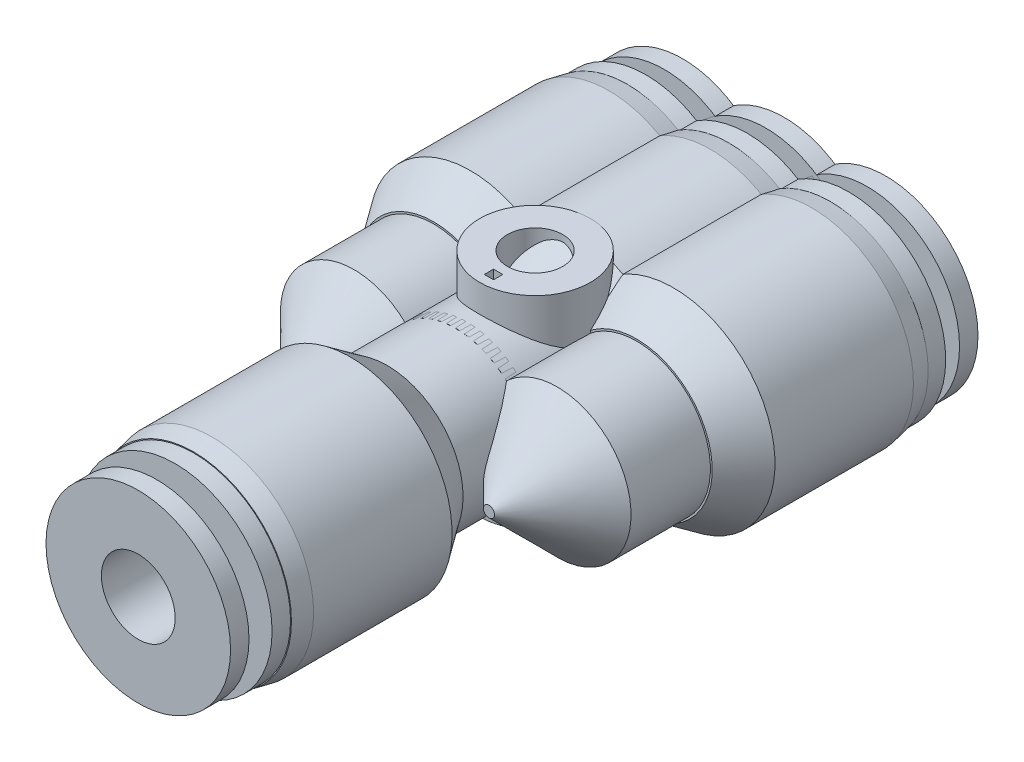
from build123d import *

# Parameters (mm, degrees)
SKETCH1_R           = 5
BOSS_EXTRUDE1_DEPTH = 1
SKETCH3_R           = 3
BOSS_EXTRUDE2_DEPTH = 1
SKETCH4_R           = 5.25
BOSS_EXTRUDE3_DEPTH = 1
SKETCH5_R           = 5.5
BOSS_EXTRUDE4_DEPTH = 10.5
SKETCH6_R           = 4
BOSS_EXTRUDE5_DEPTH = 8
CHAMFER1_SIZE       = 0.2
CHAMFER1_SIZE2      = 1
CHAMFER2_SIZE       = 2
CHAMFER2_SIZE2      = 1.4
CHAMFER3_SIZE       = 3.7
SKETCH11_R          = 2
CUT_EXTRUDE2_DEPTH  = 10
LPATTERN1_COUNT     = 3
LPATTERN1_PITCH     = 5.5
SKETCH8_R           = 3
BOSS_EXTRUDE7_DEPTH = 5.5
SKETCH9_R           = 1.5
CUT_EXTRUDE1_DEPTH  = 41.227478171
SKETCH12_W          = 0.5
SKETCH12_H          = 0.5
CUT_EXTRUDE3_DEPTH  = 0.5


with BuildPart() as part:
    # Sketch1 → Boss-Extrude1 (new body)
    with BuildSketch(Plane.XY):
        Circle(SKETCH1_R)
    extrude(amount=BOSS_EXTRUDE1_DEPTH)

    # Sketch3 → Boss-Extrude2 (add)
    with BuildSketch(Plane.XY.offset(1)):
        Circle(SKETCH3_R)
    extrude(amount=BOSS_EXTRUDE2_DEPTH)

    # Sketch4 → Boss-Extrude3 (add)
    with BuildSketch(Plane.XY.offset(2)):
        Circle(SKETCH4_R)
    extrude(amount=BOSS_EXTRUDE3_DEPTH)

    # Sketch5 → Boss-Extrude4 (add)
    with BuildSketch(Plane.XY.offset(3)):
        with Locations(Location((0, 0, 0), (0, 0, 180))):
            Circle(SKETCH5_R)
    extrude(amount=BOSS_EXTRUDE4_DEPTH)

    # Sketch6 → Boss-Extrude5 (add)
    with BuildSketch(Plane.XY.offset(13.5)):
        Circle(SKETCH6_R)
    extrude(amount=BOSS_EXTRUDE5_DEPTH)

    # Chamfer1
    chamfer1_edges = [part.edges().sort_by_distance(p)[0] for p in [
        (5.5, 0, 3),
    ]]
    chamfer1_side = [part.faces().sort_by_distance(p)[0] for p in [
        (5.344436508, 0, 3),
    ]]
    chamfer(chamfer1_edges, length=CHAMFER1_SIZE, length2=CHAMFER1_SIZE2, reference=chamfer1_side[0])

    # Chamfer2
    chamfer2_edges = [part.edges().sort_by_distance(p)[0] for p in [
        (5.5, 0, 13.5),
    ]]
    chamfer2_side = [part.faces().sort_by_distance(p)[0] for p in [
        (5.5, 0, 8.75),
    ]]
    chamfer(chamfer2_edges, length=CHAMFER2_SIZE, length2=CHAMFER2_SIZE2, reference=chamfer2_side[0])

    # Chamfer3
    chamfer3_edges = [part.edges().sort_by_distance(p)[0] for p in [
        (-4, 0, 21.5),
    ]]
    chamfer(chamfer3_edges, length=CHAMFER3_SIZE)

    # Sketch11 → Cut-Extrude2 (cut)
    with BuildSketch(Plane(origin=(0, 0, 0), x_dir=(-1, 0, 0), z_dir=(0, 0, -1))):
        Circle(SKETCH11_R)
    extrude(amount=-CUT_EXTRUDE2_DEPTH, mode=Mode.SUBTRACT)


with BuildPart() as lpattern1_1:
    # LPattern1: pattern copy
    add(part.part.moved(Location(Vector(1, 0, 0) * (1 * LPATTERN1_PITCH))))


with BuildPart() as lpattern1_2:
    # LPattern1: pattern copy
    add(part.part.moved(Location(Vector(1, 0, 0) * (2 * LPATTERN1_PITCH))))


with BuildPart() as body_4:
    # Mirror1: mirrored copy
    add(lpattern1_1.part.mirror(Plane.XY.offset(17.5)))


with BuildPart() as body_5:
    # Sketch8 → Boss-Extrude7 (new, symmetric)
    with BuildSketch(Plane(origin=(0, 0, 0), x_dir=(1, 0, 0), z_dir=(0, 1, 0))):
        with Locations(Location((5.5, -13.5, 0), (0, 0, 270))):
            Circle(SKETCH8_R)
    extrude(amount=BOSS_EXTRUDE7_DEPTH, both=True)


with BuildPart() as cut_extrude1_tool:
    # Sketch9 → Cut-Extrude1 (new, through all)
    with BuildSketch(Plane(origin=(0, 5.5, 0), x_dir=(1, 0, 0), z_dir=(0, 1, 0))):
        with Locations(Location((5.5, -13.5, 0), (0, 0, 270))):
            Circle(SKETCH9_R)
    extrude(amount=-CUT_EXTRUDE1_DEPTH)


with BuildPart() as part_1:
    add(part.part)

    # Cut-Extrude1: cut by cut_extrude1_tool
    add(cut_extrude1_tool.part, mode=Mode.SUBTRACT)


with BuildPart() as lpattern1_2_1:
    add(lpattern1_2.part)

    # Cut-Extrude1: cut by cut_extrude1_tool
    add(cut_extrude1_tool.part, mode=Mode.SUBTRACT)


with BuildPart() as body_4_1:
    add(body_4.part)

    # Cut-Extrude1: cut by cut_extrude1_tool
    add(cut_extrude1_tool.part, mode=Mode.SUBTRACT)


with BuildPart() as body_5_1:
    add(body_5.part)

    # Cut-Extrude1: cut by cut_extrude1_tool
    add(cut_extrude1_tool.part, mode=Mode.SUBTRACT)

    # Sketch12 → Cut-Extrude3 (cut)
    with BuildSketch(Plane(origin=(0, 5.5, 0), x_dir=(1, 0, 0), z_dir=(0, 1, 0))):
        with Locations((5.5, -15.75)):
            Rectangle(SKETCH12_W, SKETCH12_H)
    extrude(amount=-CUT_EXTRUDE3_DEPTH, mode=Mode.SUBTRACT)


solid = Compound([lpattern1_1.part, part_1.part, lpattern1_2_1.part, body_4_1.part, body_5_1.part])
